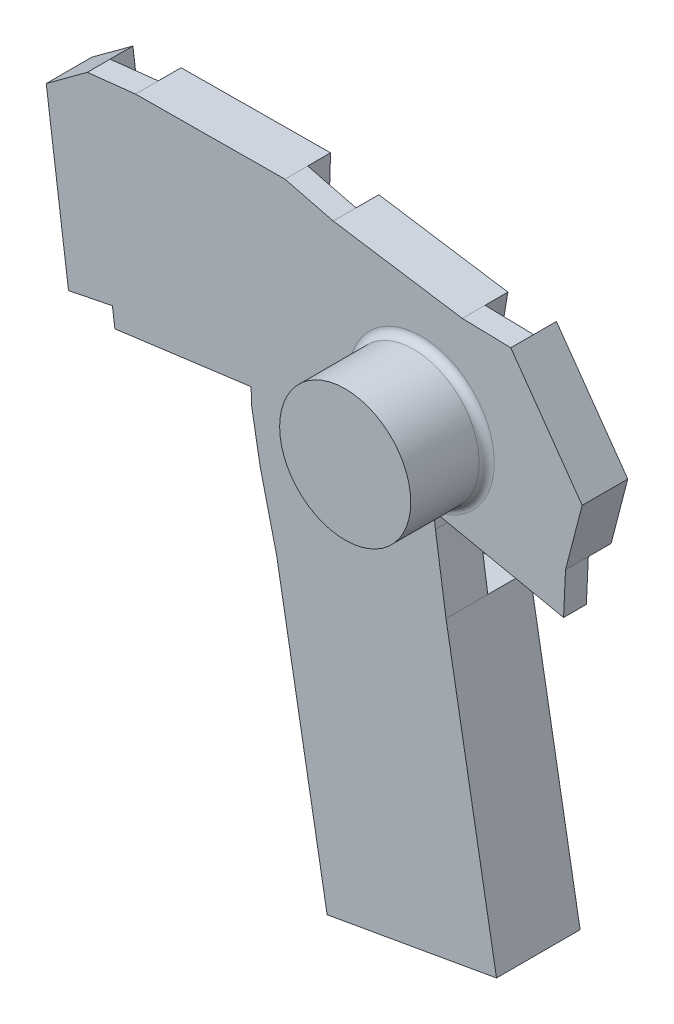
from build123d import *

# Parameters (mm, degrees)
BOSS_EXTRUDE1_DEPTH   = 3
BOSS_EXTRUDE1_2_DEPTH = 3
BOSS_EXTRUDE1_3_DEPTH = 3
BOSS_EXTRUDE1_4_DEPTH = 3
BOSS_EXTRUDE1_5_DEPTH = 3
BOSS_EXTRUDE1_6_DEPTH = 3
BOSS_EXTRUDE2_DEPTH   = 3
BOSS_EXTRUDE3_DEPTH   = 4
BOSS_EXTRUDE4_DEPTH   = 5
BOSS_EXTRUDE5_DEPTH   = 2.5
SKETCH7_R             = 8.625
BOSS_EXTRUDE6_DEPTH   = 10
FILLET1_R             = 1


with BuildPart() as part:
    # Sketch1 → Boss-Extrude1 (new body)
    with BuildSketch(Plane.XY):
        Polygon((-157.708306786, 40.356035083), (-152.304819575, 44.329897546), (-149.391723249, 22.316986717), (-150.505818609, 20.162863795), (-151.029240558, 19.996298037), (-154.910321184, 19.21296233), align=None)
    extrude(amount=-BOSS_EXTRUDE1_DEPTH)



with BuildPart() as body_2:
    # Sketch1 → Boss-Extrude1 2 (new body)
    with BuildSketch(Plane.XY):
        Polygon((-143.200182369, 23.681067988), (-141.771708727, 22.942272705), (-141.417062609, 23.055129835), (-128.353286026, 23.842538892), (-126.923061182, 25.367546815), (-126.299118711, 45.160018639), (-145.963883673, 45.026358385), align=None)
    extrude(amount=-BOSS_EXTRUDE1_2_DEPTH)


with BuildPart() as body_3:
    # Sketch1 → Boss-Extrude1 3 (new body)
    with BuildSketch(Plane.XY):
        Polygon((-107.452313856, 22.751941247), (-105.8273555, 24.022922299), (-102.964187331, 40.958018331), (-119.948602388, 43.563327727), (-120.531202342, 25.369443818), (-119.203583194, 24.12433954), (-118.788909935, 24.137639341), align=None)
    extrude(amount=-BOSS_EXTRUDE1_3_DEPTH)


with BuildPart() as body_4:
    # Sketch1 → Boss-Extrude1 4 (new body)
    with BuildSketch(Plane.XY):
        Polygon((-99.567663538, 22.722793004), (-98.442870148, 21.001338348), (-89.386000699, 19.102739522), (-87.194407263, 27.543337474), (-96.584441251, 40.806132568), align=None)
    extrude(amount=-BOSS_EXTRUDE1_4_DEPTH)


with BuildPart() as body_5:
    # Sketch1 → Boss-Extrude1 5 (new body)
    with BuildSketch(Plane.XY):
        Polygon((-129.565242632, 10.790123413), (-130.675013398, 17.075689336), (-130.720095352, 18.270412872), (-128.136441147, 18.426140636), (-119.436419139, 18.705176142), (-106.720361509, 17.114886687), (-106.498771051, 15.1412078), (-109.869761523, 10.324632035), (-125.066433071, 7.64152887), align=None)
    extrude(amount=-BOSS_EXTRUDE1_5_DEPTH)


with BuildPart() as body_6:
    # Sketch1 → Boss-Extrude1 6 (new body)
    with BuildSketch(Plane.XY):
        Polygon((-105.107164744, 5.681988451), (-98.463483991, -31.946767529), (-120.749282124, -35.881517012), (-127.392962877, 1.747238969), align=None)
    extrude(amount=-BOSS_EXTRUDE1_6_DEPTH)


with BuildPart() as part_1:
    add(part.part)

    add(body_2.part)  # Boss-Extrude2 merges body 2

    add(body_3.part)  # Boss-Extrude2 merges body 3

    add(body_4.part)  # Boss-Extrude2 merges body 4

    add(body_5.part)  # Boss-Extrude2 merges body 5

    add(body_6.part)  # Boss-Extrude2 merges body 6
    # Sketch2 → Boss-Extrude2 (add)
    with BuildSketch(Plane.XY):
        Polygon((-154.778828939, 18.219336743), (-149.003710401, 19.384954517), (-148.676438789, 16.911915522), (-130.758309274, 19.283125657), (-130.675013398, 17.075689336), (-129.565242632, 10.790123413), (-127.392962877, 1.747238969), (-120.749282124, -35.881517012), (-98.463483991, -31.946767529), (-105.107164744, 5.681988451), (-106.498771051, 15.1412078), (-106.720361509, 17.114886687), (-89.640117023, 13.5343413), (-89.386000699, 19.102739522), (-87.194407263, 27.543337474), (-96.584441251, 40.806132568), (-102.964187331, 40.958018331), (-119.948602388, 43.563327727), (-126.299118711, 45.160018639), (-145.963883673, 45.026358385), (-152.304819575, 44.329897546), (-157.708306786, 40.356035083), align=None)
    extrude(amount=BOSS_EXTRUDE2_DEPTH)

    # Sketch3 → Boss-Extrude3 (add)
    with BuildSketch(Plane(origin=(0, 0, -3), x_dir=(-1, 0, 0), z_dir=(0, 0, -1))):
        Polygon((119.436419139, 18.705176142), (130.720095352, 18.270412872), (130.675013398, 17.075689336), (129.565242632, 10.790123413), (125.066433071, 7.64152887), (109.869761523, 10.324632035), (106.498771051, 15.1412078), (106.720361509, 17.114886687), align=None)
    extrude(amount=BOSS_EXTRUDE3_DEPTH)

    # Sketch4 → Boss-Extrude4 (add)
    with BuildSketch(Plane(origin=(0, 0, -3), x_dir=(-1, 0, 0), z_dir=(0, 0, -1))):
        Polygon((105.107164744, 5.681988451), (127.392962877, 1.747238969), (120.749282124, -35.881517012), (98.463483991, -31.946767529), align=None)
    extrude(amount=BOSS_EXTRUDE4_DEPTH)

    # Sketch5 → Boss-Extrude5 (add)
    with BuildSketch(Plane(origin=(0, 0, 0), x_dir=(-1, 0, 0), z_dir=(0, 0, -1))):
        Polygon((106.498771051, 15.1412078), (105.107164744, 5.681988451), (127.392962877, 1.747238969), (129.565242632, 10.790123413), (125.066433071, 7.64152887), (109.869761523, 10.324632035), align=None)
    extrude(amount=BOSS_EXTRUDE5_DEPTH)

    # Sketch7 → Boss-Extrude6 (add)
    with BuildSketch(Plane.XY.offset(3)):
        with Locations((-108.375015851, 26.614118497)):
            Circle(SKETCH7_R)
    extrude(amount=BOSS_EXTRUDE6_DEPTH)

    # Fillet1
    fillet1_edges = [part_1.edges().sort_by_distance(p)[0] for p in [
        (-117.000015851, 26.614118497, 3),
    ]]
    fillet(fillet1_edges, radius=FILLET1_R)


solid = part_1.part
